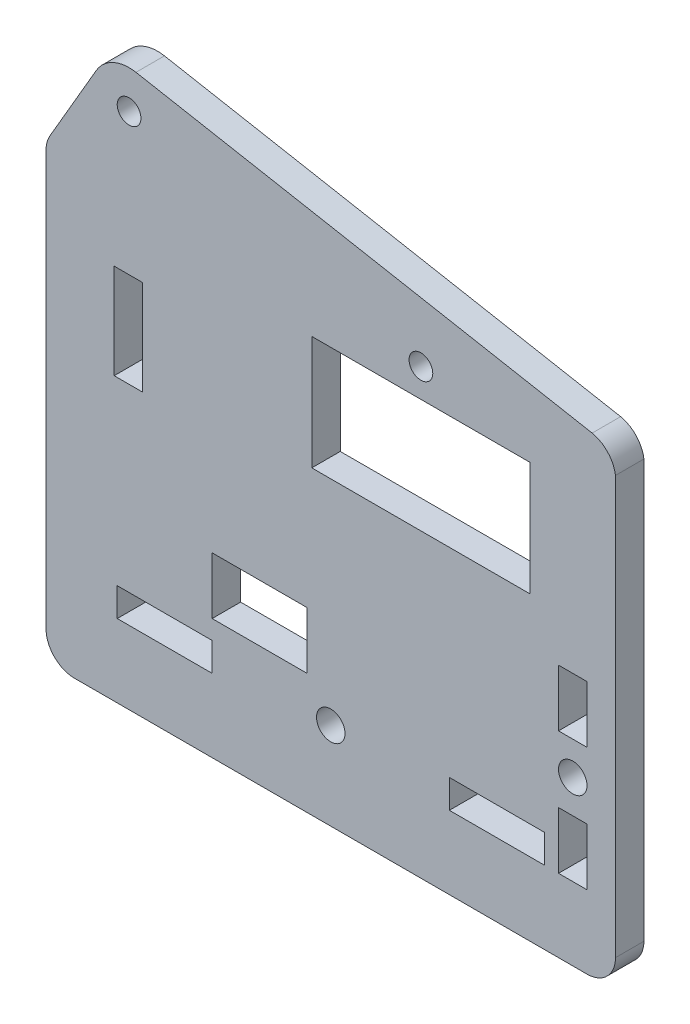
from build123d import *

# Parameters (mm, degrees)
SKETCH_1_R      = 1.25
SKETCH_1_R_2    = 1.500000002
SKETCH_1_W      = 22.999938461
SKETCH_1_H      = 12.000117949
SKETCH_1_W_2    = 2.999969231
SKETCH_1_H_2    = 6.000015385
SKETCH_1_W_3    = 9.999984615
SKETCH_1_H_3    = 3.000051282
SKETCH_1_W_4    = 10
SKETCH_1_H_4    = 6
SKETCH_1_W_5    = 9.999984616
EXTRUDE_1_DEPTH = 3


with BuildPart() as part:
    # 草圖1 → 填料-伸長1 (new body)
    with BuildSketch(Plane.XY):
        with BuildLine():
            Line((149.545923845, 145.649704894), (101.475469426, 154.53805141))
            ThreePointArc((101.475469426, 154.53805141), (99.077497598, 154.23914087), (97.289259558, 152.613772878))
            Line((97.289259558, 152.613772878), (92.406316445, 144.206797918))
            ThreePointArc((92.406316445, 144.206797918), (92.103687803, 143.480249781), (92.000408718, 142.7))
            Line((92.000408718, 142.7), (92.0003, 99))
            ThreePointArc((92.0003, 99), (92.878928766, 96.87870585), (95.000184615, 95.999984616))
            Line((95.000184615, 95.999984616), (149.000184614, 95.999707693))
            ThreePointArc((149.000184614, 95.999707693), (151.121568411, 96.878376105), (152.000399999, 98.999692307))
            Line((152.000399999, 98.999692307), (152.001144765, 143.013690924))
            ThreePointArc((152.001144765, 143.013690924), (151.188953144, 144.718624927), (149.545923845, 145.649704894))
        make_face()
        with Locations((131.500611289, 142.699797442)):
            Circle(SKETCH_1_R, mode=Mode.SUBTRACT)
        with Locations((147.500257437, 113.199715383)):
            Circle(SKETCH_1_R_2, mode=Mode.SUBTRACT)
        with Locations((122.000316411, 105.199794873)):
            Circle(SKETCH_1_R_2, mode=Mode.SUBTRACT)
        with Locations((100.748149255, 150.60475514)):
            Circle(SKETCH_1_R, mode=Mode.SUBTRACT)
        Polygon((102.176568231, 125.699947814), (99.176568231, 125.699963199), (99.176619513, 135.699963199), (102.176619513, 135.699947814), align=None, mode=Mode.SUBTRACT)
        with Locations((131.500362564, 133.699797435)):
            Rectangle(SKETCH_1_W, SKETCH_1_H, mode=Mode.SUBTRACT)
        with Locations((147.500290769, 119.699715384)):
            Rectangle(SKETCH_1_W_2, SKETCH_1_H_2, mode=Mode.SUBTRACT)
        with Locations((139.50021641, 105.19975641)):
            Rectangle(SKETCH_1_W_3, SKETCH_1_H_3, mode=Mode.SUBTRACT)
        with Locations((147.500224102, 106.699715384)):
            Rectangle(SKETCH_1_W_2, SKETCH_1_H_2, mode=Mode.SUBTRACT)
        with Locations((114.500224102, 111.699910257)):
            Rectangle(SKETCH_1_W_4, SKETCH_1_H_4, mode=Mode.SUBTRACT)
        with Locations((104.50021641, 105.199935898)):
            Rectangle(SKETCH_1_W_5, SKETCH_1_H_3, mode=Mode.SUBTRACT)
    extrude(amount=EXTRUDE_1_DEPTH)


solid = part.part
